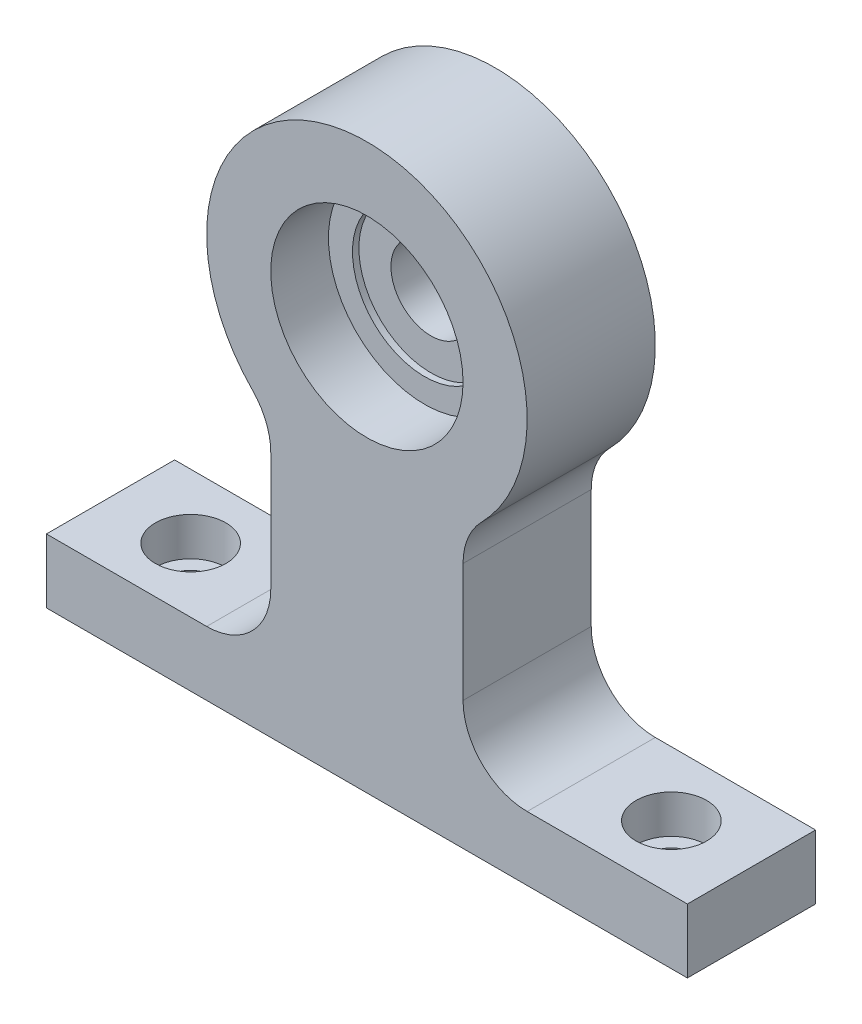
from build123d import *

# Parameters (mm, degrees)
SKETCH1_R                      = 15
BOSS_EXTRUDE1_DEPTH            = 10
SKETCH2_R                      = 15
SKETCH2_R_2                    = 6.25
BOSS_EXTRUDE2_DEPTH            = 10
FILLET1_R                      = 10
CBORE_FOR_M6_SHCS1_D           = 6.6
CBORE_FOR_M6_SHCS1_CBORE_D     = 11
CBORE_FOR_M6_SHCS1_CBORE_DEPTH = 6
SKETCH5_R                      = 15
SKETCH5_R_2                    = 11.25
BOSS_EXTRUDE3_DEPTH            = 1


with BuildPart() as part:
    # Sketch1 → Boss-Extrude1 (new, symmetric)
    with BuildSketch(Plane.XY):
        with BuildLine():
            Line((15, 43), (15, 10))
            Line((15, 10), (50, 10))
            Line((50, 10), (50, 0))
            Line((50, 0), (-50, 0))
            Line((-50, 0), (-50, 10))
            Line((-50, 10), (-15, 10))
            Line((-15, 10), (-15, 43))
            ThreePointArc((-15, 43), (0, 88), (15, 43))
        make_face()
        with Locations((0, 63)):
            Circle(SKETCH1_R, mode=Mode.SUBTRACT)
    extrude(amount=BOSS_EXTRUDE1_DEPTH, both=True)

    # Sketch2 → Boss-Extrude2 (add, through all)
    with BuildSketch(Plane.XY):
        with Locations((0, 63)):
            Circle(SKETCH2_R)
        with Locations((0, 63)):
            Circle(SKETCH2_R_2, mode=Mode.SUBTRACT)
    extrude(amount=-BOSS_EXTRUDE2_DEPTH)

    # Fillet1
    fillet1_edges = [part.edges().sort_by_distance(p)[0] for p in [
        (-15, 10, 0),
        (-15, 43, 0),
        (15, 43, 0),
        (15, 10, 0),
    ]]
    fillet(fillet1_edges, radius=FILLET1_R)

    # CBORE for M6 SHCS1 (through all)
    with Locations(Plane(origin=(0, 10, 0), x_dir=(1, 0, 0), z_dir=(0, 1, 0))):
        with Locations((-37.5, 0), (37.5, 0)):
            CounterBoreHole(CBORE_FOR_M6_SHCS1_D / 2, CBORE_FOR_M6_SHCS1_CBORE_D / 2, CBORE_FOR_M6_SHCS1_CBORE_DEPTH)

    # Sketch5 → Boss-Extrude3 (add)
    with BuildSketch(Plane.XY):
        with Locations((0, 63)):
            Circle(SKETCH5_R)
        with Locations((0, 63)):
            Circle(SKETCH5_R_2, mode=Mode.SUBTRACT)
    extrude(amount=BOSS_EXTRUDE3_DEPTH)


solid = part.part
